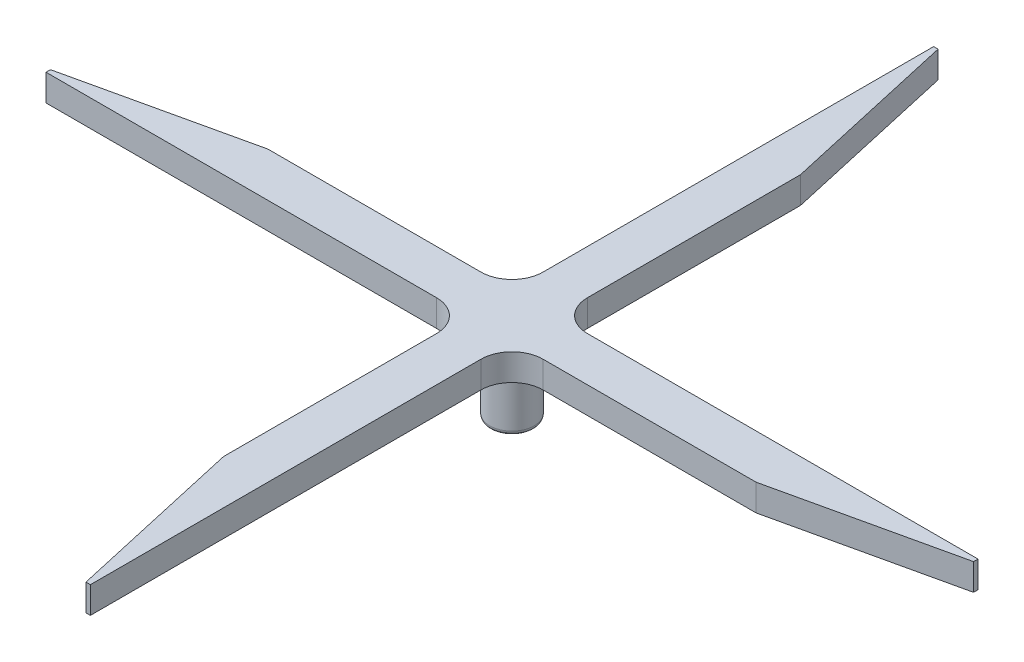
from build123d import *

# Parameters (mm, degrees)
BOSS_EXTRUDE1_DEPTH = 7.62
CUT_EXTRUDE1_DEPTH  = 180.766694357
SKETCH3_R           = 6.35
BOSS_EXTRUDE2_DEPTH = 25.4
FILLET1_R           = 1.27
FILLET2_R           = 1.27


with BuildPart() as part:
    # Sketch1 → Boss-Extrude1 (new body)
    with BuildSketch(Plane(origin=(0, 0, 0), x_dir=(1, 0, 0), z_dir=(0, 1, 0))):
        with BuildLine():
            Line((15.24, 6.35), (127, 6.35))
            Line((127, 6.35), (127, -6.35))
            Line((127, -6.35), (15.24, -6.35))
            ThreePointArc((15.24, -6.35), (8.953820715, -8.953820715), (6.35, -15.24))
            Line((6.35, -15.24), (6.35, -127))
            Line((6.35, -127), (-6.35, -127))
            Line((-6.35, -127), (-6.35, -15.24))
            ThreePointArc((-6.35, -15.24), (-8.953820715, -8.953820715), (-15.24, -6.35))
            Line((-15.24, -6.35), (-127, -6.35))
            Line((-127, -6.35), (-127, 6.35))
            Line((-127, 6.35), (-15.24, 6.35))
            ThreePointArc((-15.24, 6.35), (-8.953820715, 8.953820715), (-6.35, 15.24))
            Line((-6.35, 15.24), (-6.35, 127))
            Line((-6.35, 127), (6.35, 127))
            Line((6.35, 127), (6.35, 15.24))
            ThreePointArc((6.35, 15.24), (8.953820715, 8.953820715), (15.24, 6.35))
        make_face()
    extrude(amount=BOSS_EXTRUDE1_DEPTH)

    # Sketch2 → Cut-Extrude1 (cut, through all)
    with BuildSketch(Plane(origin=(0, 7.62, 0), x_dir=(1, 0, 0), z_dir=(0, 1, 0))):
        Polygon((127, 5.08), (76.2, -6.35), (127, -6.35), align=None)
        Polygon((-5.08, 127), (6.35, 76.2), (6.35, 127), align=None)
        Polygon((5.08, -127), (-6.35, -76.2), (-6.35, -127), align=None)
        Polygon((-127, -5.08), (-76.2, 6.35), (-127, 6.35), align=None)
    extrude(amount=-CUT_EXTRUDE1_DEPTH, mode=Mode.SUBTRACT)

    # Sketch3 → Boss-Extrude2 (add)
    with BuildSketch(Plane(origin=(0, 7.62, 0), x_dir=(1, 0, 0), z_dir=(0, 1, 0))):
        with Locations(Location((0, 0, 0), (0, 0, 270))):
            Circle(SKETCH3_R)
    extrude(amount=-BOSS_EXTRUDE2_DEPTH)

    # Fillet1
    fillet1_edges = [part.edges().sort_by_distance(p)[0] for p in [
        (0, 0, -6.35),
    ]]
    fillet(fillet1_edges, radius=FILLET1_R)

    # Fillet2
    fillet2_edges = [part.edges().sort_by_distance(p)[0] for p in [
        (0, -17.78, -6.35),
    ]]
    fillet(fillet2_edges, radius=FILLET2_R)


solid = part.part
